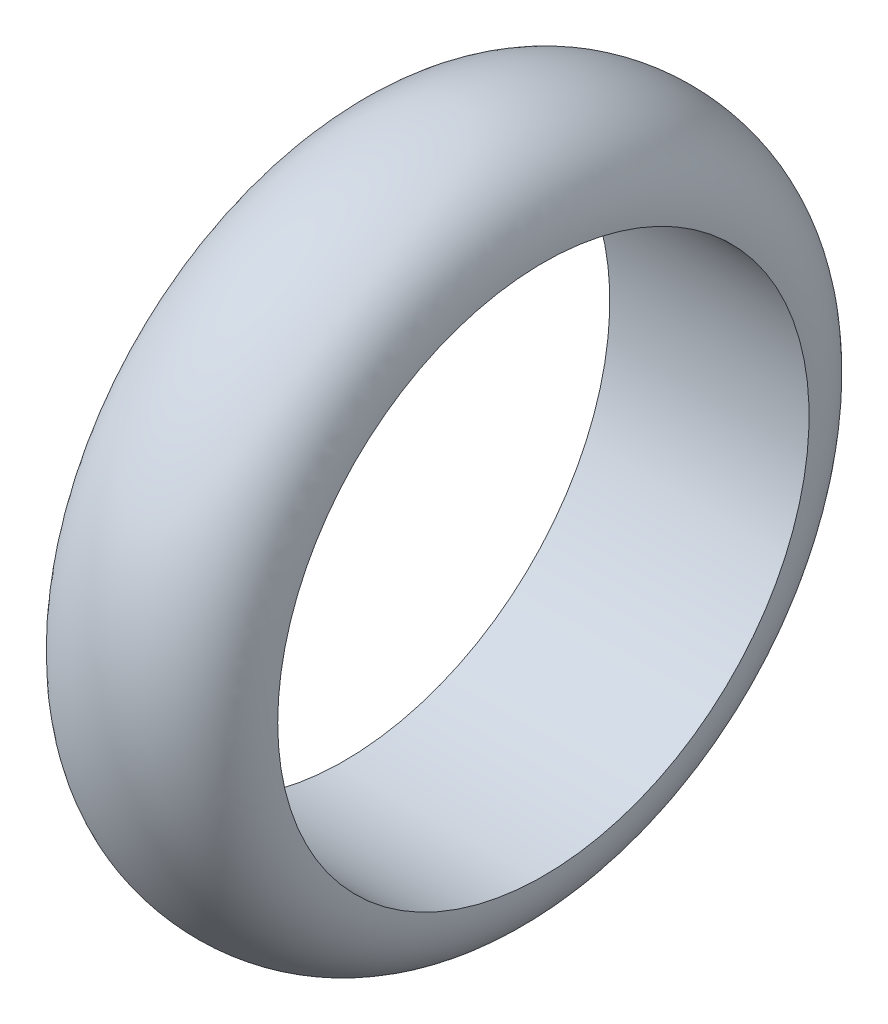
from build123d import *


with BuildPart() as part:
    # Sketch1 → Revolve1 (revolve)
    with BuildSketch(Plane(origin=(0, 0, 0), x_dir=(1, 0, 0), z_dir=(0, 1, 0)), mode=Mode.PRIVATE) as revolve1_sk:
        with BuildLine():
            add(Edge.make_bspline(
                [(0, 101.6), (0, 143.653166331), (76.2, 144.278489033), (76.2, 101.6)],
                knots=[0, 0, 0, 0, 1, 1, 1, 1], degree=3))
            Line((76.2, 101.6), (0, 101.6))
        make_face()
    revolve(revolve1_sk.sketch.rotate(Axis((0, 0, 0), (1, 0, 0)), 180), axis=Axis((0, 0, 0), (1, 0, 0)))


solid = part.part
